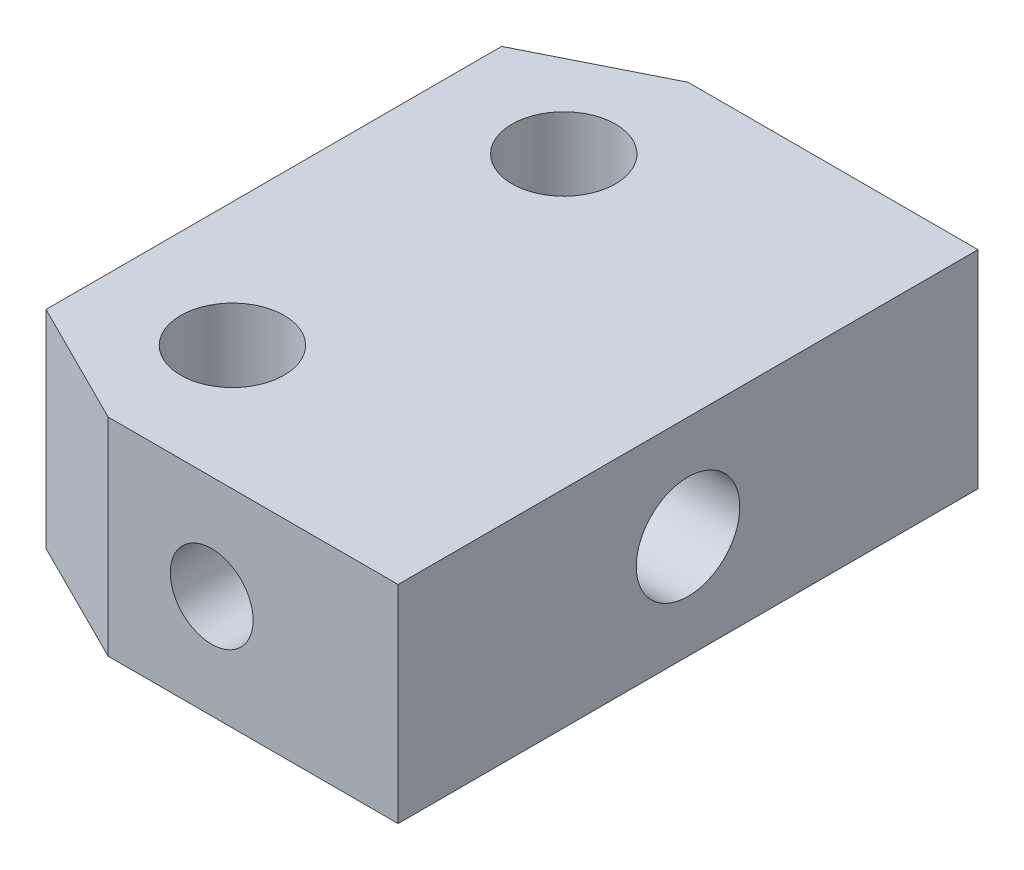
from build123d import *

# Parameters (mm, degrees)
SKETCH_1_W                = 20.000000045
SKETCH_1_H                = 28
EXTRUDE_1_DEPTH           = 10.000000062
HOLE_WIZARD_5_0_5_1_D     = 5
HOLE_WIZARD_5_0_5_2_D     = 5
HOLE_WIZARD_4_0_4_1_D     = 4
HOLE_WIZARD_4_0_4_1_DEPTH = 40.5
CHAMFER_1_SIZE            = 3.000000071
CHAMFER_1_SIZE2           = 6.000000142


with BuildPart() as part:
    # 草图1 → 凸台-拉伸1 (new body)
    with BuildSketch(Plane(origin=(0, -65.00000108, 0), x_dir=(1, 0, 0), z_dir=(0, 1, 0))):
        with Locations((59.999999934, 33.500000026)):
            Rectangle(SKETCH_1_W, SKETCH_1_H)
    extrude(amount=-EXTRUDE_1_DEPTH)

    # Ø5.0 (5) 直径孔1 (through all)
    with Locations(Plane(origin=(0, -75.000001142, 0), x_dir=(-1, 0, 0), z_dir=(0, -1, 0))):
        with Locations((-55.999998876, 25.500000109), (-55.999998876, 41.500000109)):
            Hole(HOLE_WIZARD_5_0_5_1_D / 2)

    # Ø5.0 (5) 直径孔2 (through all)
    with Locations(Plane.ZY.offset(-49.999999911)):
        with Locations((-33.500000026, -70.000000195)):
            Hole(HOLE_WIZARD_5_0_5_2_D / 2)

    # Ø4.0 (4) 直径孔1
    with Locations(Plane(origin=(0, 0, -47.500000026), x_dir=(-1, 0, 0), z_dir=(0, 0, -1))):
        with Locations((-61, -70)):
            Hole(HOLE_WIZARD_4_0_4_1_D / 2, depth=HOLE_WIZARD_4_0_4_1_DEPTH)

    # 倒角1
    chamfer_1_edges = [part.edges().sort_by_distance(p)[0] for p in [
        (49.999999911, -70.000001111, -47.500000026),
        (49.999999911, -70.000001111, -19.500000026),
    ]]
    chamfer_1_side = [part.faces().sort_by_distance(p)[0] for p in [
        (49.999999911, -70.000001111, -47.202678651),
    ]]
    chamfer(chamfer_1_edges, length=CHAMFER_1_SIZE, length2=CHAMFER_1_SIZE2, reference=chamfer_1_side[0])


solid = part.part
